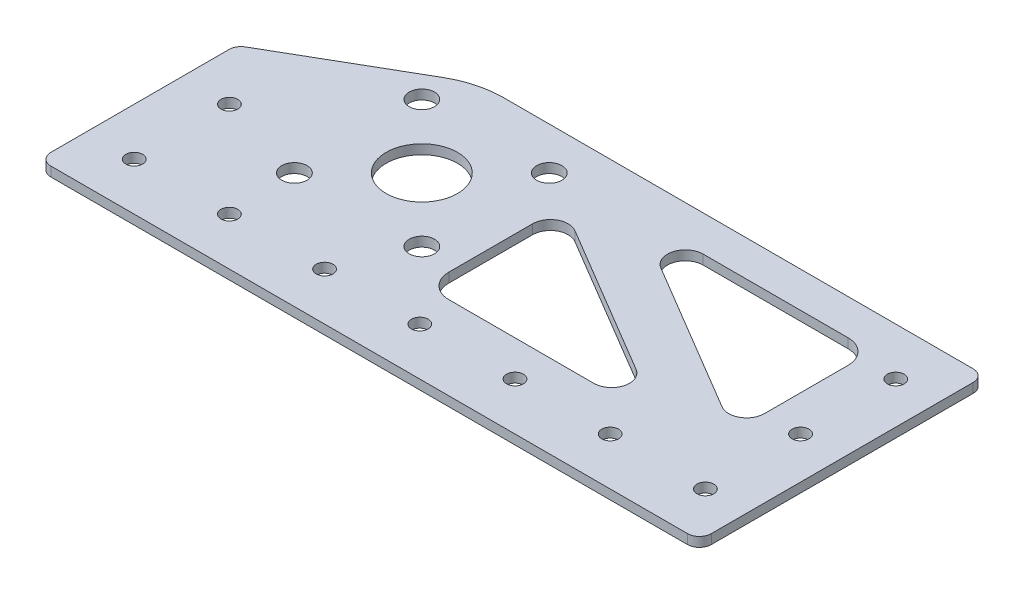
from build123d import *

# Parameters (mm, degrees)
BOSS_EXTRUDE1_DEPTH     = 2.54
F_8_CLEARANCE_HOLE1_D   = 4.4958
F_1_4_CLEARANCE_HOLE1_D = 6.7564
SKETCH6_R               = 9.525
CUT_EXTRUDE1_DEPTH      = 192.999314468


with BuildPart() as part:
    # Sketch1 → Boss-Extrude1 (new body)
    with BuildSketch(Plane(origin=(0, 0, 0), x_dir=(1, 0, 0), z_dir=(0, 1, 0))):
        with BuildLine():
            Line((0, 50.726050891), (0, 3.175))
            ThreePointArc((0, 3.175), (0.92993597, 0.92993597), (3.175, 0))
            Line((3.175, 0), (173.0375, 0))
            ThreePointArc((173.0375, 0), (175.28256403, 0.92993597), (176.2125, 3.175))
            Line((176.2125, 3.175), (176.2125, 73.025))
            ThreePointArc((176.2125, 73.025), (175.28256403, 75.27006403), (173.0375, 76.2))
            Line((173.0375, 76.2), (47.753083613, 76.2))
            ThreePointArc((47.753083613, 76.2), (41.179079868, 75.334515988), (35.053083613, 72.797045256))
            Line((35.053083613, 72.797045256), (1.5875, 53.475681548))
            ThreePointArc((1.5875, 53.475681548), (0.425369343, 52.313550891), (0, 50.726050891))
        make_face()
    extrude(amount=BOSS_EXTRUDE1_DEPTH)

    # #8 Clearance Hole1 (through all)
    with Locations(Plane(origin=(0, 2.54, 0), x_dir=(1, 0, 0), z_dir=(0, 1, 0))):
        with Locations((12.7, 12.7), (38.1, 12.7), (88.9, 12.7), (63.5, 12.7), (114.3, 12.7), (139.7, 12.7), (165.1, 12.7), (165.1, 63.5), (165.1, 38.1), (12.7, 38.1)):
            Hole(F_8_CLEARANCE_HOLE1_D / 2)

    # 1/4 Clearance Hole1 (through all)
    with Locations(Plane(origin=(0, 2.54, 0), x_dir=(1, 0, 0), z_dir=(0, 1, 0))):
        with Locations((37.25, 30.9), (37.25, 64.9), (71.25, 64.9), (71.25, 30.9)):
            Hole(F_1_4_CLEARANCE_HOLE1_D / 2)

    # Sketch6 → Cut-Extrude1 (cut, through all)
    with BuildSketch(Plane.XZ):
        with Locations(Location((54.25, -47.9, 0), (0, 0, 270))):
            Circle(SKETCH6_R)
        with BuildLine():
            Line((149.225, -66.675), (110.541932823, -66.675))
            ThreePointArc((110.541932823, -66.675), (105.949557162, -63.174043513), (108.108974619, -57.818343112))
            Line((108.108974619, -57.818343112), (148.379541796, -33.887504729))
            ThreePointArc((148.379541796, -33.887504729), (153.167753999, -33.842315673), (155.575, -37.981661618))
            Line((155.575, -37.981661618), (155.575, -60.325))
            ThreePointArc((155.575, -60.325), (153.715128061, -64.815128061), (149.225, -66.675))
        make_face()
        with BuildLine():
            Line((125.808067177, -22.225), (87.125, -22.225))
            ThreePointArc((87.125, -22.225), (82.634871939, -24.084871939), (80.775, -28.575))
            Line((80.775, -28.575), (80.775, -50.918338382))
            ThreePointArc((80.775, -50.918338382), (83.182246001, -55.057684327), (87.970458204, -55.012495271))
            Line((87.970458204, -55.012495271), (128.241025381, -31.081656888))
            ThreePointArc((128.241025381, -31.081656888), (130.400442838, -25.725956487), (125.808067177, -22.225))
        make_face()
    extrude(amount=-CUT_EXTRUDE1_DEPTH, mode=Mode.SUBTRACT)


solid = part.part
